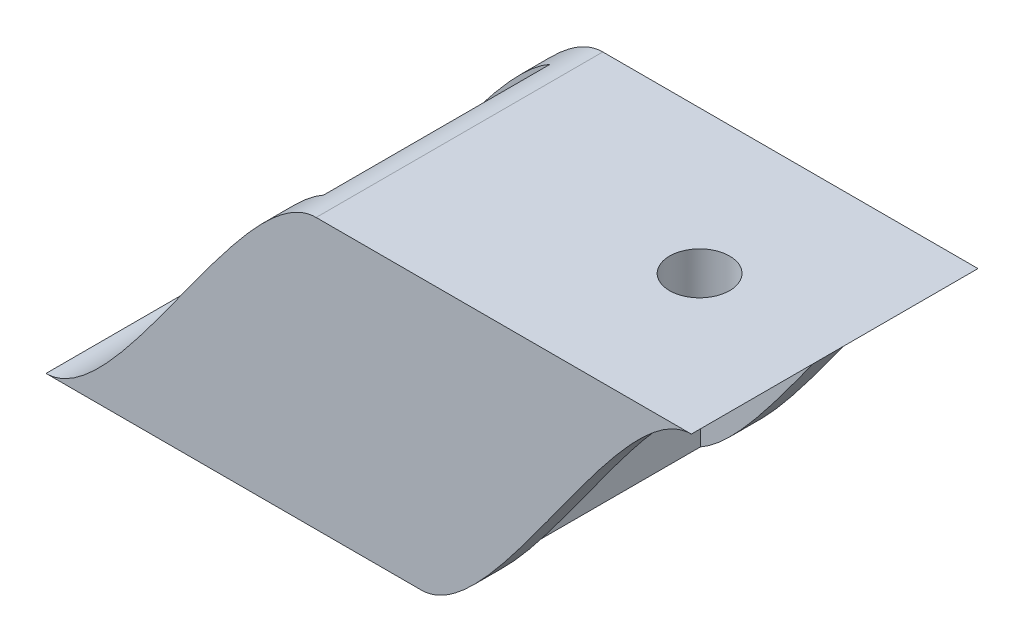
from build123d import *

# Parameters (mm, degrees)
SKETCH1_W           = 86
SKETCH1_H           = 36
BOSS_EXTRUDE1_DEPTH = 38.2
CUT_EXTRUDE2_DEPTH  = 101.753362227
SKETCH3_R           = 4
CUT_EXTRUDE5_DEPTH  = 101.753362386
SKETCH3_9_R         = 4
CUT_EXTRUDE7_DEPTH  = 101.753362386
SKETCH6_W           = 33
SKETCH6_H           = 30.2
CUT_EXTRUDE8_DEPTH  = 32.2
CUT_EXTRUDE9_START  = -6
SKETCH6_8_W         = 33
SKETCH6_8_H         = 30.2
CUT_EXTRUDE9_DEPTH  = 95.753362386


with BuildPart() as part:
    # Sketch1 → Boss-Extrude1 (new body)
    with BuildSketch(Plane.XY):
        with Locations((43, 18)):
            Rectangle(SKETCH1_W, SKETCH1_H)
    extrude(amount=BOSS_EXTRUDE1_DEPTH)

    # Sketch2 → Cut-Extrude2 (cut, through all)
    with BuildSketch(Plane.XY):
        with BuildLine():
            Line((86, 36), (86, 0))
            Line((86, 0), (50, 0))
            add(Edge.make_bspline(
                [(50, 0), (60, 0), (76, 36), (86, 36)],
                knots=[0, 0, 0, 0, 1, 1, 1, 1], degree=3))
        make_face()
        with BuildLine():
            Line((36, 36), (0, 36))
            Line((0, 36), (0, 0))
            add(Edge.make_bspline(
                [(36, 36), (26, 36), (10, 0), (0, 0)],
                knots=[0, 0, 0, 0, 1, 1, 1, 1], degree=3))
        make_face()
    extrude(amount=CUT_EXTRUDE2_DEPTH, mode=Mode.SUBTRACT)

    # Sketch3 → Cut-Extrude5 (cut, through all)
    with BuildSketch(Plane(origin=(0, 0, 0), x_dir=(1, 0, 0), z_dir=(0, 1, 0))):
        with Locations((18, -19.1)):
            Circle(SKETCH3_R)
    extrude(amount=CUT_EXTRUDE5_DEPTH, mode=Mode.SUBTRACT)

    # Sketch3<9> → Cut-Extrude7 (cut, through all)
    with BuildSketch(Plane(origin=(0, 0, 0), x_dir=(1, 0, 0), z_dir=(0, 1, 0))):
        with Locations((68, -19.1)):
            Circle(SKETCH3_9_R)
    extrude(amount=CUT_EXTRUDE7_DEPTH, mode=Mode.SUBTRACT)

    # Sketch6 → Cut-Extrude8 (cut)
    with BuildSketch(Plane(origin=(0, 36, 0), x_dir=(1, 0, 0), z_dir=(0, 1, 0))):
        with Locations((16.5, -19.1)):
            Rectangle(SKETCH6_W, SKETCH6_H)
    extrude(amount=-CUT_EXTRUDE8_DEPTH, mode=Mode.SUBTRACT)

    # Sketch6<8> → Cut-Extrude9 (cut, through all)
    with BuildSketch(Plane(origin=(0, 36, 0), x_dir=(1, 0, 0), z_dir=(0, 1, 0)).offset(CUT_EXTRUDE9_START)):
        with Locations((69.5, -19.1)):
            Rectangle(SKETCH6_8_W, SKETCH6_8_H)
    extrude(amount=-CUT_EXTRUDE9_DEPTH, mode=Mode.SUBTRACT)


solid = part.part
